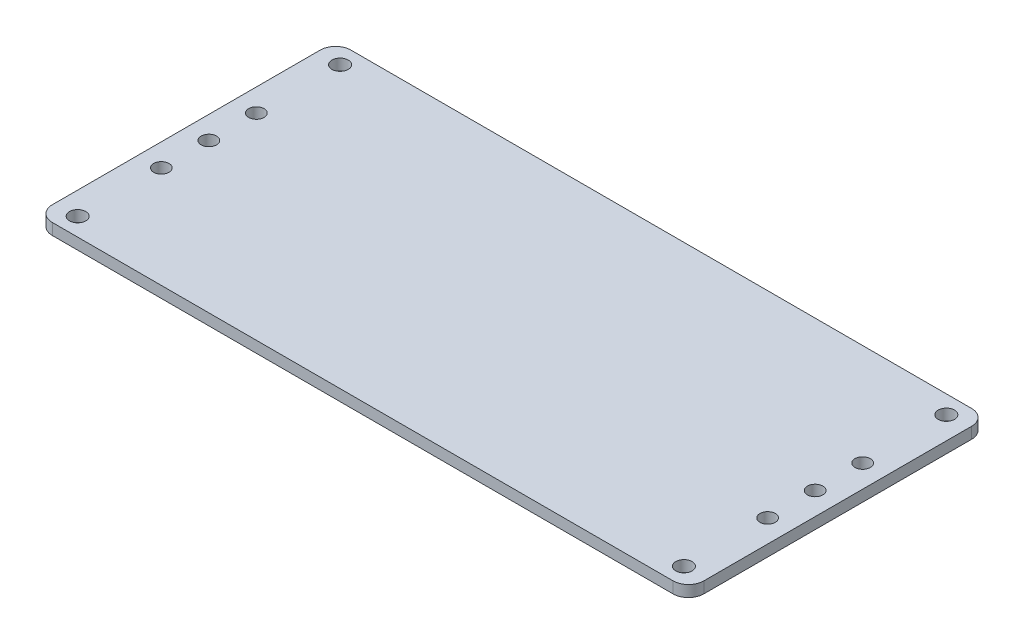
from build123d import *

# Parameters (mm, degrees)
SKETCH_1_W      = 144
SKETCH_1_H      = 66
SKETCH_1_R      = 1.8
SKETCH_1_R_2    = 1.7
EXTRUDE_1_DEPTH = 2.5
FILLET_1_R      = 3.4


with BuildPart() as part:
    # 草图1 → 凸台-拉伸1 (new body)
    with BuildSketch(Plane(origin=(0, 0, 0), x_dir=(1, 0, 0), z_dir=(0, 1, 0))):
        Rectangle(SKETCH_1_W, SKETCH_1_H)
        with Locations(Location((-67, 29, 0), (0, 0, 270))):
            Circle(SKETCH_1_R, mode=Mode.SUBTRACT)
        with Locations(Location((67, 29, 0), (0, 0, 270))):
            Circle(SKETCH_1_R, mode=Mode.SUBTRACT)
        with Locations(Location((-67, -29, 0), (0, 0, 270))):
            Circle(SKETCH_1_R, mode=Mode.SUBTRACT)
        with Locations(Location((67, -29, 0), (0, 0, 270))):
            Circle(SKETCH_1_R, mode=Mode.SUBTRACT)
        with Locations(Location((-67, 0, 0), (0, 0, 270))):
            Circle(SKETCH_1_R_2, mode=Mode.SUBTRACT)
        with Locations(Location((-67, 10.5, 0), (0, 0, 270))):
            Circle(SKETCH_1_R_2, mode=Mode.SUBTRACT)
        with Locations(Location((-67, -10.5, 0), (0, 0, 270))):
            Circle(SKETCH_1_R_2, mode=Mode.SUBTRACT)
        with Locations(Location((67, 0, 0), (0, 0, 270))):
            Circle(SKETCH_1_R_2, mode=Mode.SUBTRACT)
        with Locations(Location((67, 10.5, 0), (0, 0, 270))):
            Circle(SKETCH_1_R_2, mode=Mode.SUBTRACT)
        with Locations(Location((67, -10.5, 0), (0, 0, 270))):
            Circle(SKETCH_1_R_2, mode=Mode.SUBTRACT)
    extrude(amount=EXTRUDE_1_DEPTH)

    # 圆角1
    fillet_1_edges = [part.edges().sort_by_distance(p)[0] for p in [
        (72, 1.25, 33),
        (-72, 1.25, 33),
        (-72, 1.25, -33),
        (72, 1.25, -33),
    ]]
    fillet(fillet_1_edges, radius=FILLET_1_R)


solid = part.part
